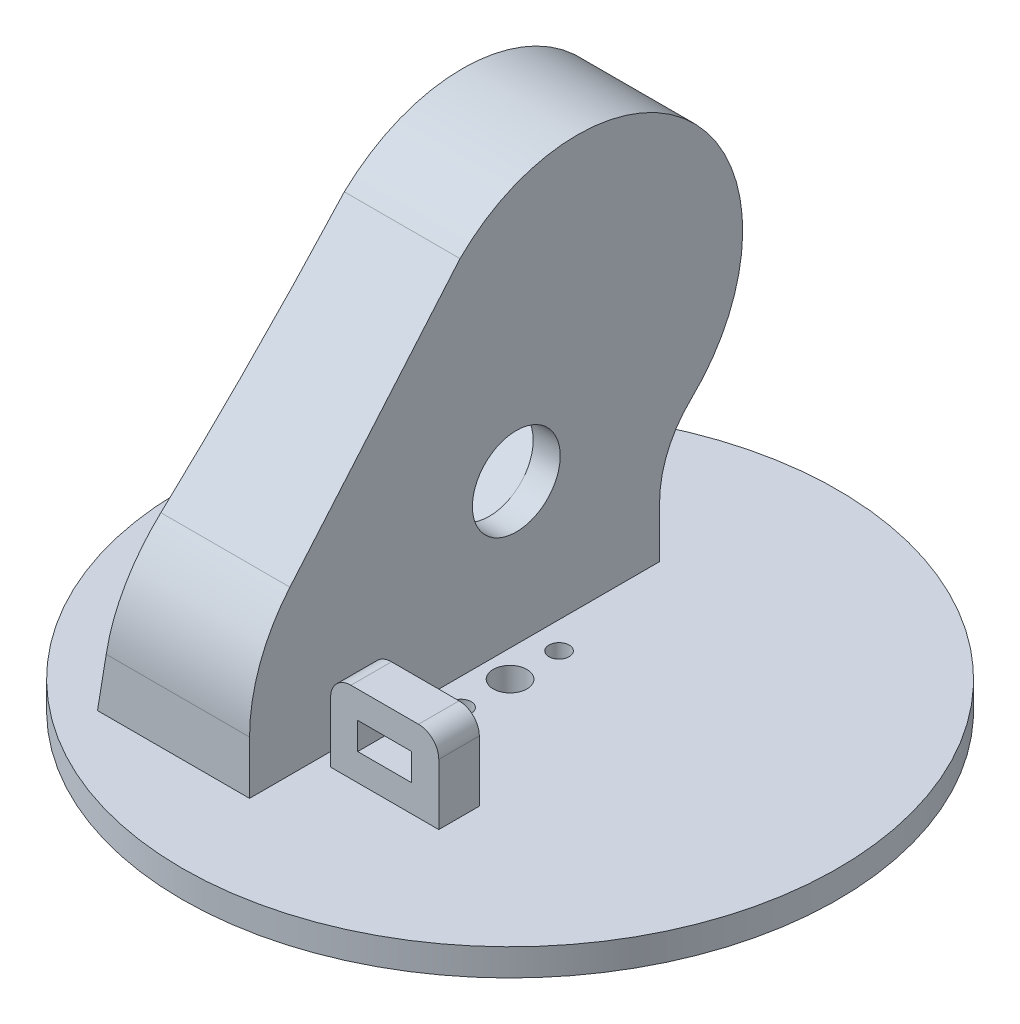
from build123d import *

# Parameters (mm, degrees)
SKETCH2_R                       = 48.5
BOSS_EXTRUDE1_DEPTH             = 4
SKETCH4_R                       = 1.5
CUT_EXTRUDE2_DEPTH              = 69.705894944
SKETCH5_R                       = 2.5
CUT_EXTRUDE3_DEPTH              = 69.705894944
BOSS_EXTRUDE2_DEPTH             = 14
BOSS_EXTRUDE7_DEPTH             = 9
BOSS_EXTRUDE7_DIRECTION_2_REACH = 104.912
BOSS_EXTRUDE10_DEPTH            = 9
SKETCH27_W                      = 16
SKETCH27_H                      = 6
BOSS_EXTRUDE11_DEPTH            = 12
FILLET6_R                       = 3
CUT_EXTRUDE16_REACH             = 111.016
SKETCH28_W                      = 8
SKETCH28_H                      = 4
CUT_EXTRUDE17_DEPTH             = 95.342420983
CUT_EXTRUDE17_DEPTH_BACK        = 95.342420983
SKETCH31_R                      = 6.5
CUT_EXTRUDE18_DEPTH             = 105.740118374
CUT_EXTRUDE19_DEPTH             = 10
SKETCH32_R                      = 0.92049896
CUT_EXTRUDE20_DEPTH             = 4
SKETCH32_3_R                    = 0.92049896
CUT_EXTRUDE21_DEPTH             = 4


with BuildPart() as part:
    # Sketch2 → Boss-Extrude1 (new body)
    with BuildSketch(Plane(origin=(0, 0, 0), x_dir=(1, 0, 0), z_dir=(0, 1, 0))):
        with Locations(Location((0, 0, 0), (0, 0, 270))):
            Circle(SKETCH2_R)
    extrude(amount=BOSS_EXTRUDE1_DEPTH)

    # Sketch4 → Cut-Extrude2 (cut, through all)
    with BuildSketch(Plane.XZ):
        with Locations(Location((0, 7.25, 0), (0, 0, 270))):
            Circle(SKETCH4_R)
        with Locations(Location((0, -7.25, 0), (0, 0, 270))):
            Circle(SKETCH4_R)
    extrude(amount=-CUT_EXTRUDE2_DEPTH, mode=Mode.SUBTRACT)

    # Sketch5 → Cut-Extrude3 (cut, through all)
    with BuildSketch(Plane.XZ):
        with Locations(Location((0, 0, 0), (0, 0, 270))):
            Circle(SKETCH5_R)
    extrude(amount=-CUT_EXTRUDE3_DEPTH, mode=Mode.SUBTRACT)

    # Sketch7 → Boss-Extrude2 (add)
    with BuildSketch(Plane(origin=(-4, 0, 0), x_dir=(0, 0, -1), z_dir=(1, 0, 0))):
        with BuildLine():
            Line((23.129947874, 4), (23.129947874, 11.644549616))
            ThreePointArc((23.129947874, 11.644549616), (24.589048403, 18.743749901), (28.729797284, 24.692011643))
            ThreePointArc((28.729797284, 24.692011643), (29.313383054, 55.284736897), (-1.284289494, 55.479275971))
            Line((-1.284289494, 55.479275971), (-27.227315747, 29.536249718))
            ThreePointArc((-27.227315747, 29.536249718), (-32.64663453, 21.425665997), (-34.549646217, 11.858580188))
            Line((-34.549646217, 11.858580188), (-34.549646217, 4))
            Line((-34.549646217, 4), (23.129947874, 4))
        make_face()
    extrude(amount=-BOSS_EXTRUDE2_DEPTH)

    # Sketch17 → Boss-Extrude7 (add)
    with BuildSketch(Plane.ZY.offset(18)):
        with BuildLine():
            ThreePointArc((34.549646217, 11.858580188), (33.008342843, 20.500891953), (28.574482006, 28.077569775))
            ThreePointArc((28.574482006, 28.077569775), (27.915386359, 28.820289685), (27.227315747, 29.536249718))
            Line((27.227315747, 29.536249718), (1.284289494, 55.479275971))
            Line((1.284289494, 55.479275971), (26.295003593, 26.127182305))
            ThreePointArc((26.295003593, 26.127182305), (30.194232218, 19.461281607), (31.549646217, 11.858580188))
            Line((31.549646217, 11.858580188), (31.549646217, 4))
            Line((31.549646217, 4), (34.549646217, 4))
            Line((34.549646217, 4), (34.549646217, 11.858580188))
        make_face()
        with BuildLine():
            Line((28.574482006, 28.077569775), (3.405609837, 57.600596315))
            ThreePointArc((3.405609837, 57.600596315), (-31.461505391, 57.378912253), (-30.796489049, 22.517434639))
            ThreePointArc((-30.796489049, 22.517434639), (-27.345864981, 17.560549854), (-26.129947874, 11.644549616))
            Line((-26.129947874, 11.644549616), (-26.129947874, 4))
            Line((-26.129947874, 4), (-23.129947874, 4))
            Line((-23.129947874, 4), (-23.129947874, 11.644549616))
            ThreePointArc((-23.129947874, 11.644549616), (-24.589048403, 18.743749901), (-28.729797284, 24.692011643))
            ThreePointArc((-28.729797284, 24.692011643), (-29.313383054, 55.284736897), (1.284289494, 55.479275971))
            Line((1.284289494, 55.479275971), (27.227315747, 29.536249718))
            ThreePointArc((27.227315747, 29.536249718), (27.915386359, 28.820289685), (28.574482006, 28.077569775))
        make_face()
    extrude(amount=BOSS_EXTRUDE7_DEPTH)

    # Boss-Extrude7 direction 2: up to this face of the body (flat: up to its plane)
    boss_extrude7_direction_2_end = Plane(part.part.faces().sort_by_distance((-4, 29.339157607, -2.736239069))[0])
    # Sketch17 → Boss-Extrude7 direction 2 (add, up to the picked face)
    with BuildSketch(Plane.ZY.offset(18), mode=Mode.PRIVATE) as boss_extrude7_direction_2_sk1:
        with BuildLine():
            ThreePointArc((34.549646217, 11.858580188), (33.008342843, 20.500891953), (28.574482006, 28.077569775))
            ThreePointArc((28.574482006, 28.077569775), (27.915386359, 28.820289685), (27.227315747, 29.536249718))
            Line((27.227315747, 29.536249718), (1.284289494, 55.479275971))
            Line((1.284289494, 55.479275971), (26.295003593, 26.127182305))
            ThreePointArc((26.295003593, 26.127182305), (30.194232218, 19.461281607), (31.549646217, 11.858580188))
            Line((31.549646217, 11.858580188), (31.549646217, 4))
            Line((31.549646217, 4), (34.549646217, 4))
            Line((34.549646217, 4), (34.549646217, 11.858580188))
        make_face()
    boss_extrude7_direction_2_tool1 = split(extrude(boss_extrude7_direction_2_sk1.sketch, amount=-BOSS_EXTRUDE7_DIRECTION_2_REACH, mode=Mode.PRIVATE), bisect_by=boss_extrude7_direction_2_end, keep=Keep.BOTH, mode=Mode.PRIVATE)
    # Sketch17 → Boss-Extrude7 direction 2 (add, up to the picked face)
    with BuildSketch(Plane.ZY.offset(18), mode=Mode.PRIVATE) as boss_extrude7_direction_2_sk2:
        with BuildLine():
            Line((28.574482006, 28.077569775), (3.405609837, 57.600596315))
            ThreePointArc((3.405609837, 57.600596315), (-31.461505391, 57.378912253), (-30.796489049, 22.517434639))
            ThreePointArc((-30.796489049, 22.517434639), (-27.345864981, 17.560549854), (-26.129947874, 11.644549616))
            Line((-26.129947874, 11.644549616), (-26.129947874, 4))
            Line((-26.129947874, 4), (-23.129947874, 4))
            Line((-23.129947874, 4), (-23.129947874, 11.644549616))
            ThreePointArc((-23.129947874, 11.644549616), (-24.589048403, 18.743749901), (-28.729797284, 24.692011643))
            ThreePointArc((-28.729797284, 24.692011643), (-29.313383054, 55.284736897), (1.284289494, 55.479275971))
            Line((1.284289494, 55.479275971), (27.227315747, 29.536249718))
            ThreePointArc((27.227315747, 29.536249718), (27.915386359, 28.820289685), (28.574482006, 28.077569775))
        make_face()
    boss_extrude7_direction_2_tool2 = split(extrude(boss_extrude7_direction_2_sk2.sketch, amount=-BOSS_EXTRUDE7_DIRECTION_2_REACH, mode=Mode.PRIVATE), bisect_by=boss_extrude7_direction_2_end, keep=Keep.BOTH, mode=Mode.PRIVATE)
    add(boss_extrude7_direction_2_tool1.solids().sort_by(Axis((-18, 4.612919, 33.049646), (1, 0, 0)))[0])
    add(boss_extrude7_direction_2_tool2.solids().sort_by(Axis((-18, 43.147366, 14.895406), (1, 0, 0)))[0])

    # Sketch25 → Boss-Extrude10 (add)
    with BuildSketch(Plane.ZY.offset(18)):
        with BuildLine():
            ThreePointArc((-28.729797284, 24.692011643), (-24.589048403, 18.743749901), (-23.129947874, 11.644549616))
            Line((-23.129947874, 11.644549616), (-23.129947874, 4))
            Line((-23.129947874, 4), (-15.129947874, 4))
            add(Edge.make_bspline(
                [(-28.729797284, 24.692011643), (-21.954867515, 18.253200081), (-19.09405247, 12.798017691), (-15.129947874, 4)],
                knots=[0, 0, 0, 0, 1, 1, 1, 1], degree=3))
        make_face()
        with BuildLine():
            add(Edge.make_bspline(
                [(11.751619577, 43.19501844), (26.551255916, 25.8264495), (25.549646217, 4)],
                knots=[0, 0, 0, 1, 1, 1], degree=2))
            Line((25.549646217, 4), (31.549646217, 4))
            Line((31.549646217, 4), (31.549646217, 11.858580188))
            ThreePointArc((31.549646217, 11.858580188), (30.194232218, 19.461281607), (26.295003593, 26.127182305))
            Line((26.295003593, 26.127182305), (11.751619577, 43.19501844))
        make_face()
    extrude(amount=BOSS_EXTRUDE10_DEPTH)

    # Sketch27 → Boss-Extrude11 (add)
    with BuildSketch(Plane(origin=(0, 4, 0), x_dir=(1, 0, 0), z_dir=(0, 1, 0))):
        with Locations((6, -21.549646217)):
            Rectangle(SKETCH27_W, SKETCH27_H)
    extrude(amount=BOSS_EXTRUDE11_DEPTH)

    # Fillet6
    fillet6_edges = [part.edges().sort_by_distance(p)[0] for p in [
        (-2, 16, 21.549646217),
        (14, 16, 21.549646217),
    ]]
    fillet(fillet6_edges, radius=FILLET6_R)

    # Sketch28 → Cut-Extrude16 (cut, up to next)
    with BuildSketch(Plane.XY.offset(24.549646217), mode=Mode.PRIVATE) as cut_extrude16_sk1:
        with Locations((6, 10)):
            Rectangle(SKETCH28_W, SKETCH28_H)
    cut_extrude16_tool1 = extrude(cut_extrude16_sk1.sketch, amount=-CUT_EXTRUDE16_REACH, mode=Mode.PRIVATE) & part.part
    add(cut_extrude16_tool1.solids().sort_by_distance((6, 10, 24.549646))[0], mode=Mode.SUBTRACT)

    # Sketch29 → Cut-Extrude17 (cut, two sides: drawn at the far end of the back side and taken through both)
    with BuildSketch(Plane.XY.offset(-CUT_EXTRUDE17_DEPTH_BACK)):
        with BuildLine():
            Line((-21, 64.776480176), (-27, 64.776480176))
            Line((-27, 64.776480176), (-27, 4))
            Line((-27, 4), (-26.5, 4))
            add(Edge.make_bspline(
                [(-21, 64.776480176), (-21.220459696, 34.140901434), (-26.5, 4)],
                knots=[0, 0, 0, 1, 1, 1], degree=2))
        make_face()
    extrude(amount=CUT_EXTRUDE17_DEPTH + CUT_EXTRUDE17_DEPTH_BACK, mode=Mode.SUBTRACT)

    # Sketch31 → Cut-Extrude18 (cut, through all)
    with BuildSketch(Plane.ZY.offset(18)):
        with Locations((-4.922469695, 24.905412087)):
            Circle(SKETCH31_R)
    extrude(amount=-CUT_EXTRUDE18_DEPTH, mode=Mode.SUBTRACT)

    # Sketch31<3> → Cut-Extrude19 (cut)
    with BuildSketch(Plane.ZY.offset(18)):
        Polygon((-5.41546104, 34.054639751), (11.74960782, 18.74580534), (3.09678837, 9.043809897), (-14.06828049, 24.352644308), align=None)
    extrude(amount=-CUT_EXTRUDE19_DEPTH, mode=Mode.SUBTRACT)

    # Sketch32 → Cut-Extrude20 (cut)
    with BuildSketch(Plane.ZY.offset(18)):
        with Locations((-11.584503567, 30.654960303)):
            Circle(SKETCH32_R)
    extrude(amount=-CUT_EXTRUDE20_DEPTH, mode=Mode.SUBTRACT)

    # Sketch32<3> → Cut-Extrude21 (cut)
    with BuildSketch(Plane.ZY.offset(18)):
        with Locations((-11.584503567, 30.654960303)):
            Circle(SKETCH32_3_R)
        with Locations(Location((10.118376889, 12.711132154, 0), (0, 0, 180))):
            Circle(SKETCH32_3_R)
    extrude(amount=-CUT_EXTRUDE21_DEPTH, mode=Mode.SUBTRACT)


solid = part.part
